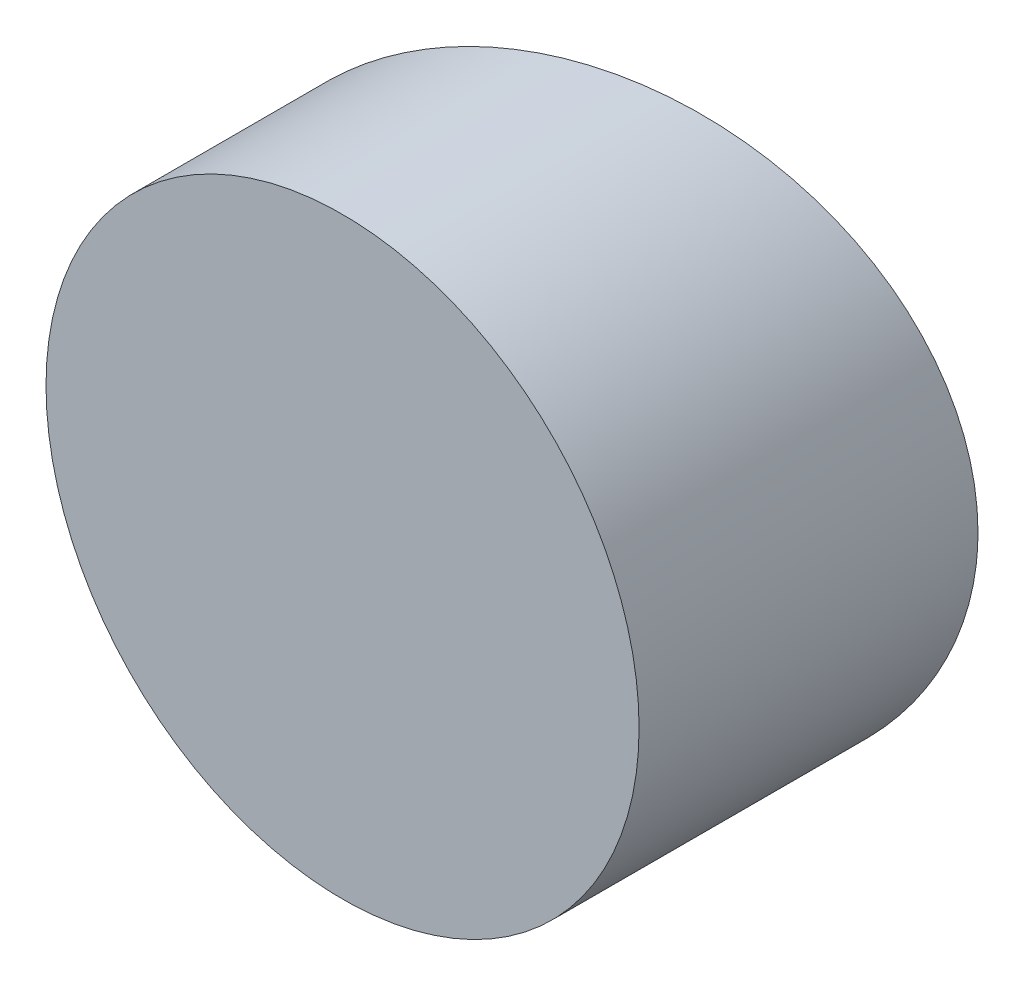
from build123d import *

# Parameters (mm, degrees)
SKETCH1_R           = 14
BOSS_EXTRUDE2_DEPTH = 16
CUT_EXTRUDE1_DEPTH  = 32


with BuildPart() as part:
    # Sketch1 → Boss-Extrude2 (new body)
    with BuildSketch(Plane.XY):
        with Locations((1.625870978, 0)):
            Circle(SKETCH1_R)
    extrude(amount=BOSS_EXTRUDE2_DEPTH)

    # Sketch2 → Cut-Extrude1 (cut)
    with BuildSketch(Plane(origin=(0, 14, 0), x_dir=(1, 0, 0), z_dir=(0, 1, 0))):
        Polygon((-12.374129022, -8), (15.625870978, 0), (-12.374129022, 0), align=None)
    extrude(amount=-CUT_EXTRUDE1_DEPTH, mode=Mode.SUBTRACT)


solid = part.part
